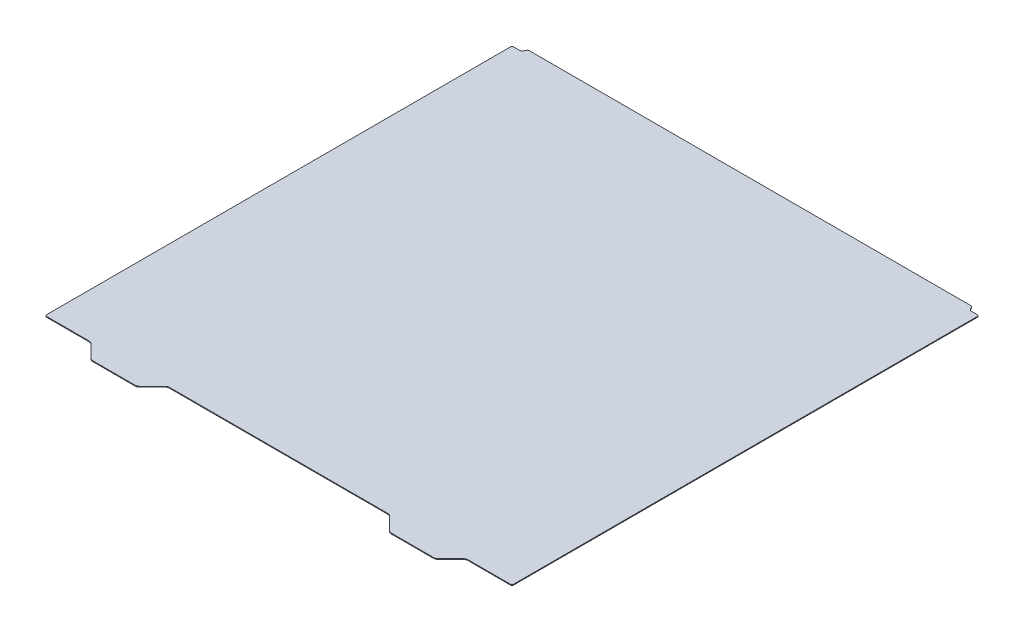
from build123d import *

# Parameters (mm, degrees)
SKETCH1_W           = 305
SKETCH1_H           = 305
BOSS_EXTRUDE1_DEPTH = 0.5
BOSS_EXTRUDE2_DEPTH = 0.5
FILLET1_R           = 1
FILLET2_R           = 1.5
FILLET3_R           = 3


with BuildPart() as part:
    # Sketch1 → Boss-Extrude1 (new body)
    with BuildSketch(Plane(origin=(0, 0, 0), x_dir=(1, 0, 0), z_dir=(0, 1, 0))):
        Rectangle(SKETCH1_W, SKETCH1_H)
    extrude(amount=BOSS_EXTRUDE1_DEPTH)

    # Sketch2 → Boss-Extrude2 (add)
    with BuildSketch(Plane(origin=(0, 0.5, 0), x_dir=(1, 0, 0), z_dir=(0, 1, 0))):
        Polygon((-72.5, -152.5), (-122.5, -152.5), (-112.5, -162.5), (-82.5, -162.5), align=None)
        Polygon((112.5, -162.5), (122.5, -152.5), (72.5, -152.5), (82.5, -162.5), align=None)
        Polygon((-144.901923792, 155.5), (-146.6339746, 152.5), (146.6339746, 152.5), (144.901923792, 155.5), align=None)
    extrude(amount=-BOSS_EXTRUDE2_DEPTH)

    # Fillet1
    fillet1_edges = [part.edges().sort_by_distance(p)[0] for p in [
        (-144.901923792, 0.25, -155.5),
        (144.901923792, 0.25, -155.5),
        (152.5, 0.25, 152.5),
        (-152.5, 0.25, 152.5),
        (-152.5, 0.25, -152.5),
        (152.5, 0.25, -152.5),
    ]]
    fillet(fillet1_edges, radius=FILLET1_R)

    # Fillet2
    fillet2_edges = [part.edges().sort_by_distance(p)[0] for p in [
        (-146.6339746, 0.25, -152.5),
        (146.6339746, 0.25, -152.5),
    ]]
    fillet(fillet2_edges, radius=FILLET2_R)

    # Fillet3
    fillet3_edges = [part.edges().sort_by_distance(p)[0] for p in [
        (-72.5, 0.25, 152.5),
        (-82.5, 0.25, 162.5),
        (-112.5, 0.25, 162.5),
        (122.5, 0.25, 152.5),
        (112.5, 0.25, 162.5),
        (82.5, 0.25, 162.5),
        (72.5, 0.25, 152.5),
        (-122.5, 0.25, 152.5),
    ]]
    fillet(fillet3_edges, radius=FILLET3_R)


solid = part.part
